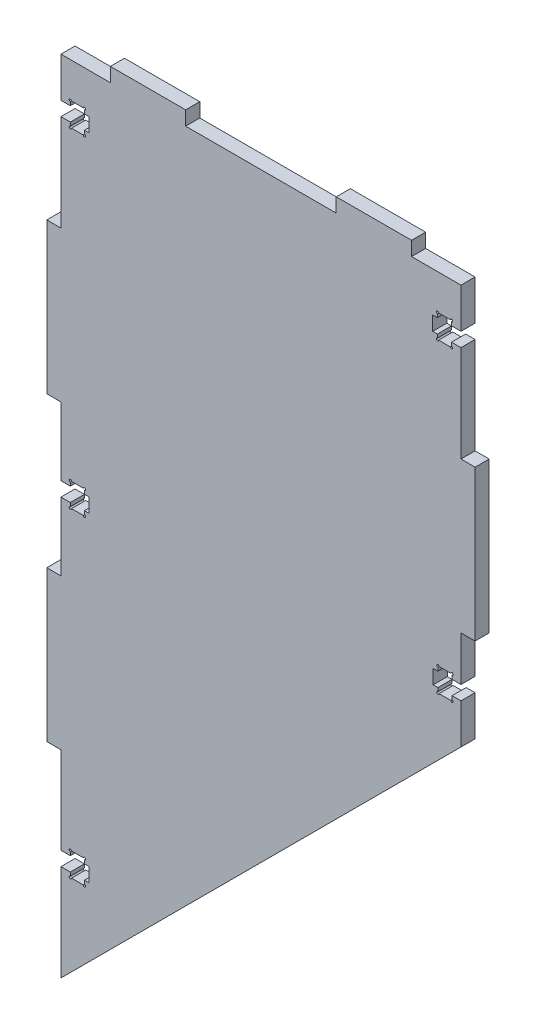
from build123d import *

# Parameters (mm, degrees)
CROQUIS1_W              = 16
CROQUIS1_H              = 3
SALIENTE_EXTRUIR1_DEPTH = 3
CORTAR_EXTRUIR1_DEPTH   = 195.118520497


with BuildPart() as part:
    # Croquis1 → Saliente-Extruir1 (new body)
    with BuildSketch(Plane.XY):
        Polygon((85, 106), (85, 85), (0, 0), (0, 42), (-3, 42), (-3, 74), (0, 74), (0, 106), (-3, 106), (-3, 138), (0, 138), (0, 170), (85, 170), (85, 138), (88, 138), (88, 106), align=None)
        with Locations((66.5, 171.5)):
            Rectangle(CROQUIS1_W, CROQUIS1_H)
        with Locations((18.5, 171.5)):
            Rectangle(CROQUIS1_W, CROQUIS1_H)
    extrude(amount=SALIENTE_EXTRUIR1_DEPTH)

    # Croquis2 → Cortar-Extruir1 (cut, through all)
    with BuildSketch(Plane.XY.offset(3)):
        with BuildLine():
            Line((2, 91.5), (0, 91.5))
            Line((0, 91.5), (0, 88.5))
            Line((0, 88.5), (2, 88.5))
            Line((2, 88.5), (2, 87.75))
            ThreePointArc((2, 87.75), (1.823223305, 87.323223305), (2.25, 87.5))
            Line((2.25, 87.5), (4.75, 87.5))
            ThreePointArc((4.75, 87.5), (5.176776695, 87.323223305), (5, 87.75))
            Line((5, 87.75), (5, 88.5))
            Line((5, 88.5), (6, 88.5))
            Line((6, 88.5), (6, 91.5))
            Line((6, 91.5), (5, 91.5))
            Line((5, 91.5), (5, 92.25))
            ThreePointArc((5, 92.25), (5.176776695, 92.676776695), (4.75, 92.5))
            Line((4.75, 92.5), (2.25, 92.5))
            ThreePointArc((2.25, 92.5), (1.823223305, 92.676776695), (2, 92.25))
            Line((2, 92.25), (2, 91.5))
        make_face()
        with BuildLine():
            Line((2, 161.5), (0, 161.5))
            Line((0, 161.5), (0, 158.5))
            Line((0, 158.5), (2, 158.5))
            Line((2, 158.5), (2, 157.75))
            ThreePointArc((2, 157.75), (1.823223305, 157.323223305), (2.25, 157.5))
            Line((2.25, 157.5), (4.75, 157.5))
            ThreePointArc((4.75, 157.5), (5.176776695, 157.323223305), (5, 157.75))
            Line((5, 157.75), (5, 158.5))
            Line((5, 158.5), (6, 158.5))
            Line((6, 158.5), (6, 161.5))
            Line((6, 161.5), (5, 161.5))
            Line((5, 161.5), (5, 162.25))
            ThreePointArc((5, 162.25), (5.176776695, 162.676776695), (4.75, 162.5))
            Line((4.75, 162.5), (2.25, 162.5))
            ThreePointArc((2.25, 162.5), (1.823223305, 162.676776695), (2, 162.25))
            Line((2, 162.25), (2, 161.5))
        make_face()
        with BuildLine():
            Line((83, 158.5), (85, 158.5))
            Line((85, 158.5), (85, 161.5))
            Line((85, 161.5), (83, 161.5))
            Line((83, 161.5), (83, 162.25))
            ThreePointArc((83, 162.25), (83.176776695, 162.676776695), (82.75, 162.5))
            Line((82.75, 162.5), (80.25, 162.5))
            ThreePointArc((80.25, 162.5), (79.823223305, 162.676776695), (80, 162.25))
            Line((80, 162.25), (80, 161.5))
            Line((80, 161.5), (79, 161.5))
            Line((79, 161.5), (79, 158.5))
            Line((79, 158.5), (80, 158.5))
            Line((80, 158.5), (80, 157.75))
            ThreePointArc((80, 157.75), (79.823223305, 157.323223305), (80.25, 157.5))
            Line((80.25, 157.5), (82.75, 157.5))
            ThreePointArc((82.75, 157.5), (83.176776695, 157.323223305), (83, 157.75))
            Line((83, 157.75), (83, 158.5))
        make_face()
        with BuildLine():
            Line((2, 23.5), (0, 23.5))
            Line((0, 23.5), (0, 20.5))
            Line((0, 20.5), (2, 20.5))
            Line((2, 20.5), (2, 19.75))
            ThreePointArc((2, 19.75), (1.823223305, 19.323223305), (2.25, 19.5))
            Line((2.25, 19.5), (4.75, 19.5))
            ThreePointArc((4.75, 19.5), (5.176776695, 19.323223305), (5, 19.75))
            Line((5, 19.75), (5, 20.5))
            Line((5, 20.5), (6, 20.5))
            Line((6, 20.5), (6, 23.5))
            Line((6, 23.5), (5, 23.5))
            Line((5, 23.5), (5, 24.25))
            ThreePointArc((5, 24.25), (5.176776695, 24.676776695), (4.75, 24.5))
            Line((4.75, 24.5), (2.25, 24.5))
            ThreePointArc((2.25, 24.5), (1.823223305, 24.676776695), (2, 24.25))
            Line((2, 24.25), (2, 23.5))
        make_face()
        with BuildLine():
            Line((83.099943711, 93.5), (85, 93.5))
            Line((85, 93.5), (85, 96.5))
            Line((85, 96.5), (83.099943711, 96.5))
            Line((83.099943711, 96.5), (83.099943711, 97.25))
            ThreePointArc((83.099943711, 97.25), (83.276720406, 97.676776695), (82.849943711, 97.5))
            Line((82.849943711, 97.5), (80.349943711, 97.5))
            ThreePointArc((80.349943711, 97.5), (79.923167016, 97.676776695), (80.099943711, 97.25))
            Line((80.099943711, 97.25), (80.099943711, 96.5))
            Line((80.099943711, 96.5), (79.099943711, 96.5))
            Line((79.099943711, 96.5), (79.099943711, 93.5))
            Line((79.099943711, 93.5), (80.099943711, 93.5))
            Line((80.099943711, 93.5), (80.099943711, 92.75))
            ThreePointArc((80.099943711, 92.75), (79.923167016, 92.323223305), (80.349943711, 92.5))
            Line((80.349943711, 92.5), (82.849943711, 92.5))
            ThreePointArc((82.849943711, 92.5), (83.276720406, 92.323223305), (83.099943711, 92.75))
            Line((83.099943711, 92.75), (83.099943711, 93.5))
        make_face()
    extrude(amount=-CORTAR_EXTRUIR1_DEPTH, mode=Mode.SUBTRACT)


solid = part.part
